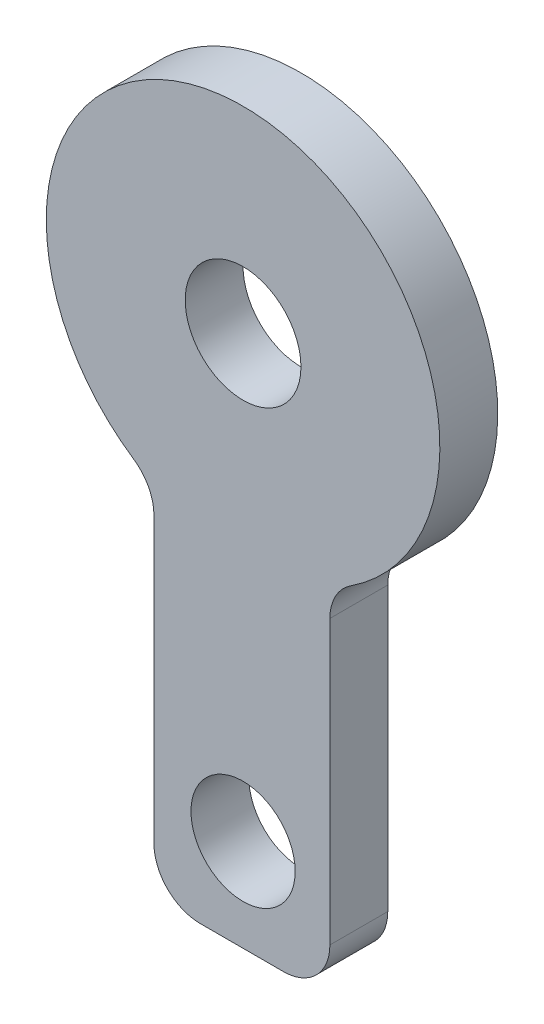
from build123d import *

# Parameters (mm, degrees)
SKETCH_1_R      = 2.5
SKETCH_1_R_2    = 2.25
EXTRUDE_1_DEPTH = 2.5
FILLET_1_R      = 2


with BuildPart() as part:
    # 草图1 → 拉伸1 (new body)
    with BuildSketch(Plane.XY):
        with BuildLine():
            Line((-3.85, -23), (-3.85, -7.578093428))
            ThreePointArc((-3.85, -7.578093428), (0.055897166, 8.499816204), (3.75, -7.628073151))
            Line((3.75, -7.628073151), (3.75, -23))
            Line((3.75, -23), (-3.85, -23))
        make_face()
        Circle(SKETCH_1_R, mode=Mode.SUBTRACT)
        with Locations((0, -19)):
            Circle(SKETCH_1_R_2, mode=Mode.SUBTRACT)
    extrude(amount=EXTRUDE_1_DEPTH)

    # 圆角1
    fillet_1_edges = [part.edges().sort_by_distance(p)[0] for p in [
        (-3.85, -23, 1.25),
        (-3.85, -7.578093428, 1.25),
        (3.75, -7.628073151, 1.25),
        (3.75, -23, 1.25),
    ]]
    fillet(fillet_1_edges, radius=FILLET_1_R)


solid = part.part
